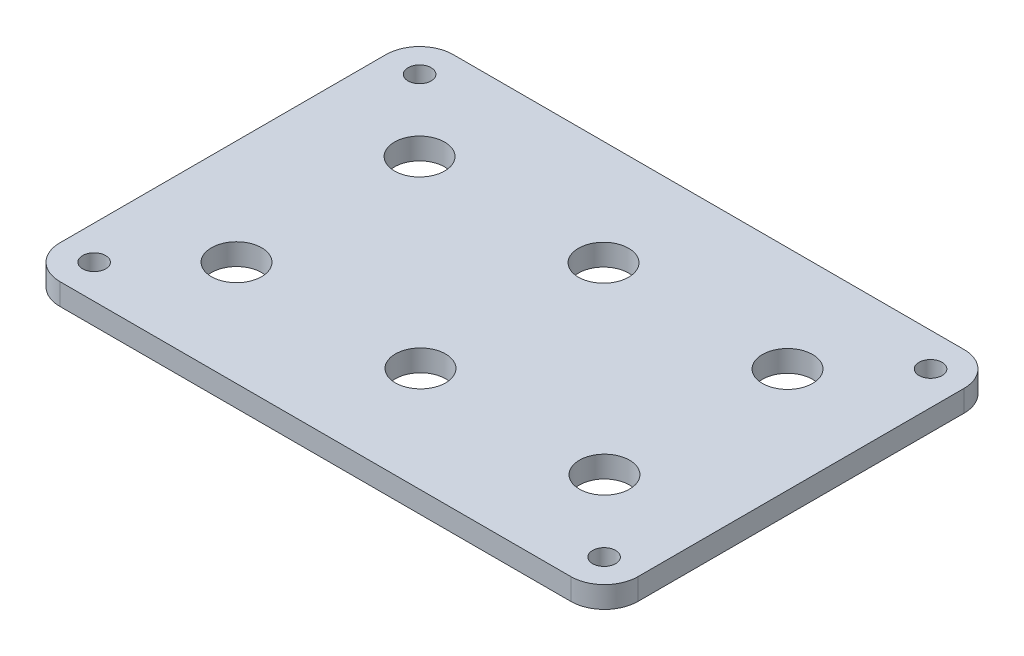
from build123d import *

# Parameters (mm, degrees)
SKETCH1_R           = 3.700636789
SKETCH1_R_2         = 3.700638134
SKETCH1_R_3         = 3.700635443
SKETCH1_R_4         = 1.700388108
SKETCH1_R_5         = 1.700390127
SKETCH1_R_6         = 1.700391472
BOSS_EXTRUDE1_DEPTH = 3.175


with BuildPart() as part:
    # Sketch1 → Boss-Extrude1 (new body)
    with BuildSketch(Plane(origin=(0, 0, 0), x_dir=(1, 0, 0), z_dir=(0, 1, 0))):
        with BuildLine():
            Line((107.487861946, 137.336384548), (32.134526478, 137.336384548))
            add(Edge.make_bspline(
                [(32.134526478, 137.336384548), (29.396970169, 137.336384548), (27.177997625, 139.555359784), (27.177997625, 142.292908018)],
                knots=[1, 1, 1, 1, 2, 2, 2, 2], degree=3))
            Line((27.177997625, 142.292908018), (27.177997625, 190.3800568))
            add(Edge.make_bspline(
                [(27.177997625, 190.3800568), (27.177997625, 193.117610417), (29.396970169, 195.336585653), (32.134526478, 195.336585653)],
                knots=[3, 3, 3, 3, 4, 4, 4, 4], degree=3))
            Line((32.134526478, 195.336585653), (107.487861946, 195.336585653))
            add(Edge.make_bspline(
                [(107.487861946, 195.336585653), (110.225420945, 195.336585653), (112.444385416, 193.1176158), (112.444385416, 190.3800568)],
                knots=[5, 5, 5, 5, 6, 6, 6, 6], degree=3))
            Line((112.444385416, 190.3800568), (112.444385416, 142.292918784))
            add(Edge.make_bspline(
                [(112.444385416, 142.292918784), (112.444385416, 139.555359784), (110.225420945, 137.336384548), (107.487861946, 137.336384548)],
                knots=[7, 7, 7, 7, 8, 8, 8, 8], degree=3))
        make_face()
        with Locations(Location((42.679056729, 179.835523857, 0), (0, 0, 270))):
            Circle(SKETCH1_R, mode=Mode.SUBTRACT)
        with Locations(Location((69.811194212, 179.835523857, 0), (0, 0, 270))):
            Circle(SKETCH1_R_2, mode=Mode.SUBTRACT)
        with Locations(Location((96.946860226, 179.835523857, 0), (0, 0, 270))):
            Circle(SKETCH1_R_3, mode=Mode.SUBTRACT)
        with Locations(Location((42.679056729, 152.837440961, 0), (0, 0, 270))):
            Circle(SKETCH1_R, mode=Mode.SUBTRACT)
        with Locations(Location((69.811194212, 152.837440961, 0), (0, 0, 270))):
            Circle(SKETCH1_R_2, mode=Mode.SUBTRACT)
        with Locations(Location((96.946860226, 152.837440961, 0), (0, 0, 270))):
            Circle(SKETCH1_R_3, mode=Mode.SUBTRACT)
        with Locations(Location((32.180389311, 190.337721152, 0), (0, 0, 270))):
            Circle(SKETCH1_R_4, mode=Mode.SUBTRACT)
        with Locations(Location((32.180389311, 142.338781618, 0), (0, 0, 270))):
            Circle(SKETCH1_R_5, mode=Mode.SUBTRACT)
        with Locations(Location((107.445530335, 142.285856339, 0), (0, 0, 270))):
            Circle(SKETCH1_R_6, mode=Mode.SUBTRACT)
        with Locations(Location((107.494913625, 190.38710848, 0), (0, 0, 270))):
            Circle(SKETCH1_R_6, mode=Mode.SUBTRACT)
    extrude(amount=BOSS_EXTRUDE1_DEPTH)


solid = part.part
